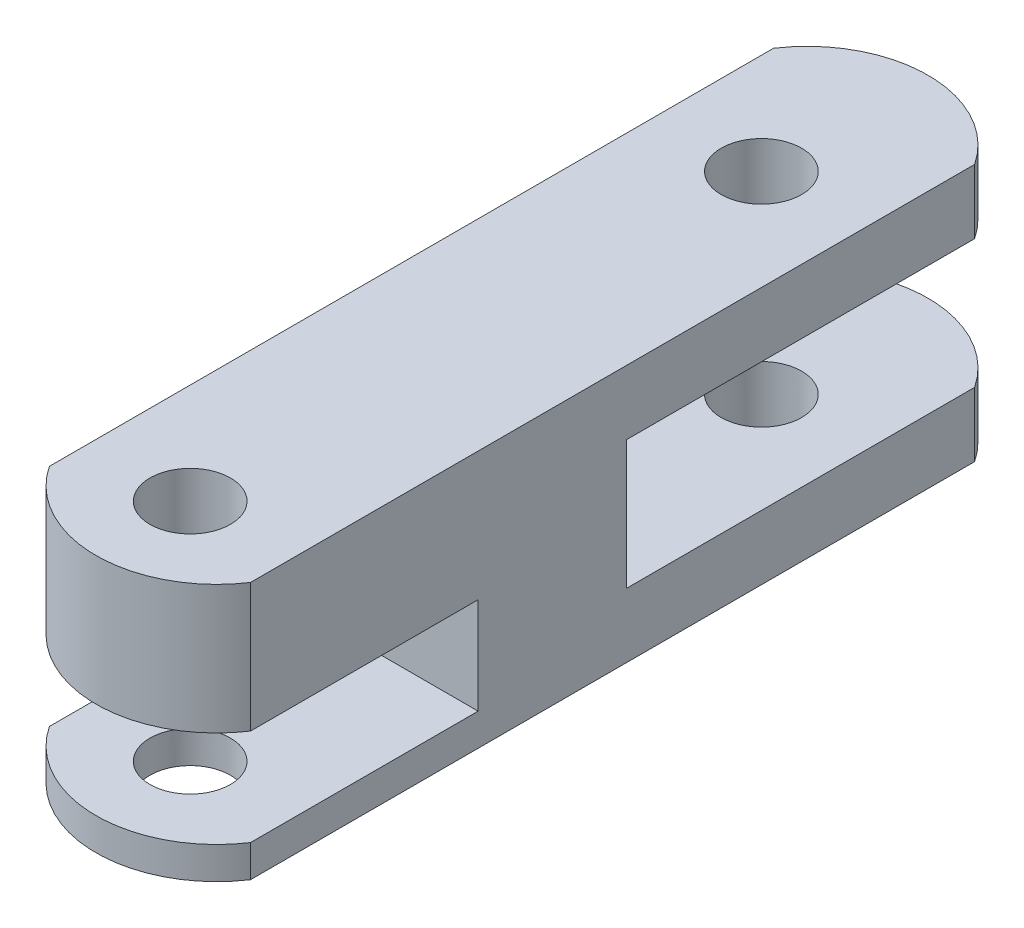
from build123d import *

# Parameters (mm, degrees)
EXTRUDE_1_DEPTH     = 16
SKETCH_2_W          = 56.583123952
SKETCH_2_H          = 12
CUT_EXTRUDE_1_DEPTH = 60.621829584
SKETCH_3_W          = 86.583123952
SKETCH_3_H          = 16
CUT_EXTRUDE_2_DEPTH = 60.621829584
SKETCH_4_R          = 5
CUT_EXTRUDE_3_DEPTH = 63.080693963


with BuildPart() as part:
    # 草图1 → 凸台-拉伸1 (new, symmetric)
    with BuildSketch(Plane(origin=(0, 0, 0), x_dir=(1, 0, 0), z_dir=(0, 1, 0))):
        with BuildLine():
            Line((-12.5, 45), (-12.5, -45))
            ThreePointArc((-12.5, -45), (0, -51.708438024), (12.5, -45))
            Line((12.5, -45), (12.5, 45))
            ThreePointArc((12.5, 45), (0, 51.708438024), (-12.5, 45))
        make_face()
    extrude(amount=EXTRUDE_1_DEPTH, both=True)

    # 草图2 → 切除-拉伸1 (cut, through all)
    with BuildSketch(Plane(origin=(12.5, 0, 0), x_dir=(0, 0, -1), z_dir=(1, 0, 0))):
        with Locations((-45, -6)):
            Rectangle(SKETCH_2_W, SKETCH_2_H)
    extrude(amount=-CUT_EXTRUDE_1_DEPTH, mode=Mode.SUBTRACT)

    # 草图3 → 切除-拉伸2 (cut, through all)
    with BuildSketch(Plane(origin=(12.5, 0, 0), x_dir=(0, 0, -1), z_dir=(1, 0, 0))):
        with Locations((45, 0)):
            Rectangle(SKETCH_3_W, SKETCH_3_H)
    extrude(amount=-CUT_EXTRUDE_2_DEPTH, mode=Mode.SUBTRACT)

    # 草图4 → 切除-拉伸3 (cut, through all)
    with BuildSketch(Plane(origin=(0, 16, 0), x_dir=(1, 0, 0), z_dir=(0, 1, 0))):
        with Locations(Location((0, -40, 0), (0, 0, 270))):
            Circle(SKETCH_4_R)
        with Locations(Location((0, 31, 0), (0, 0, 270))):
            Circle(SKETCH_4_R)
    extrude(amount=-CUT_EXTRUDE_3_DEPTH, mode=Mode.SUBTRACT)


solid = part.part
